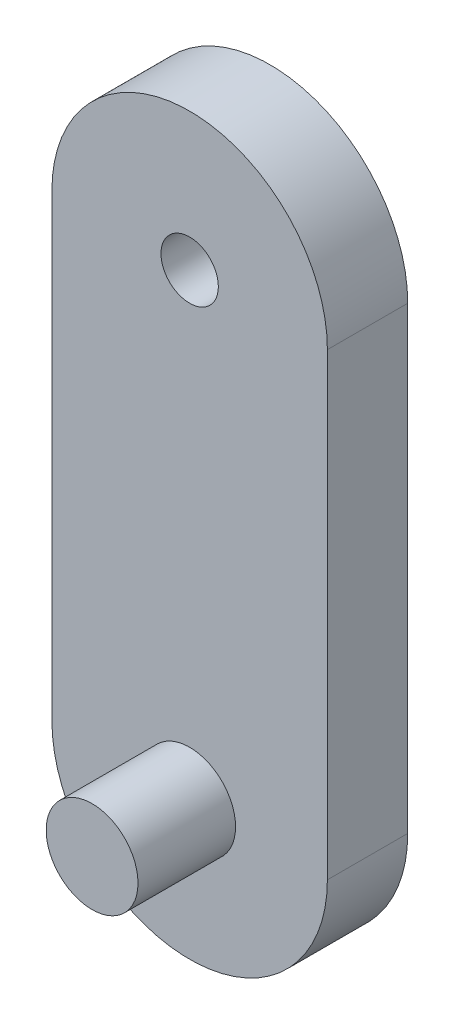
from build123d import *

# Parameters (mm, degrees)
BOSS_EXTRUDE1_DEPTH = 7
SKETCH2_R           = 4
BOSS_EXTRUDE2_DEPTH = 8.5
SKETCH3_R           = 2.5
CUT_EXTRUDE1_DEPTH  = 10.5


with BuildPart() as part:
    # Sketch1 → Boss-Extrude1 (new body)
    with BuildSketch(Plane.XY):
        with BuildLine():
            Line((0, 0), (0, 40))
            ThreePointArc((0, 40), (-12, 52), (-24, 40))
            Line((-24, 40), (-24, 0))
            ThreePointArc((-24, 0), (-12, -12), (0, 0))
        make_face()
    extrude(amount=BOSS_EXTRUDE1_DEPTH)

    # Sketch2 → Boss-Extrude2 (add)
    with BuildSketch(Plane.XY.offset(7)):
        with Locations((-12, 0)):
            Circle(SKETCH2_R)
    extrude(amount=BOSS_EXTRUDE2_DEPTH)

    # Sketch3 → Cut-Extrude1 (cut)
    with BuildSketch(Plane.XY.offset(7)):
        with Locations((-12, 40)):
            Circle(SKETCH3_R)
    extrude(amount=-CUT_EXTRUDE1_DEPTH, mode=Mode.SUBTRACT)


solid = part.part
